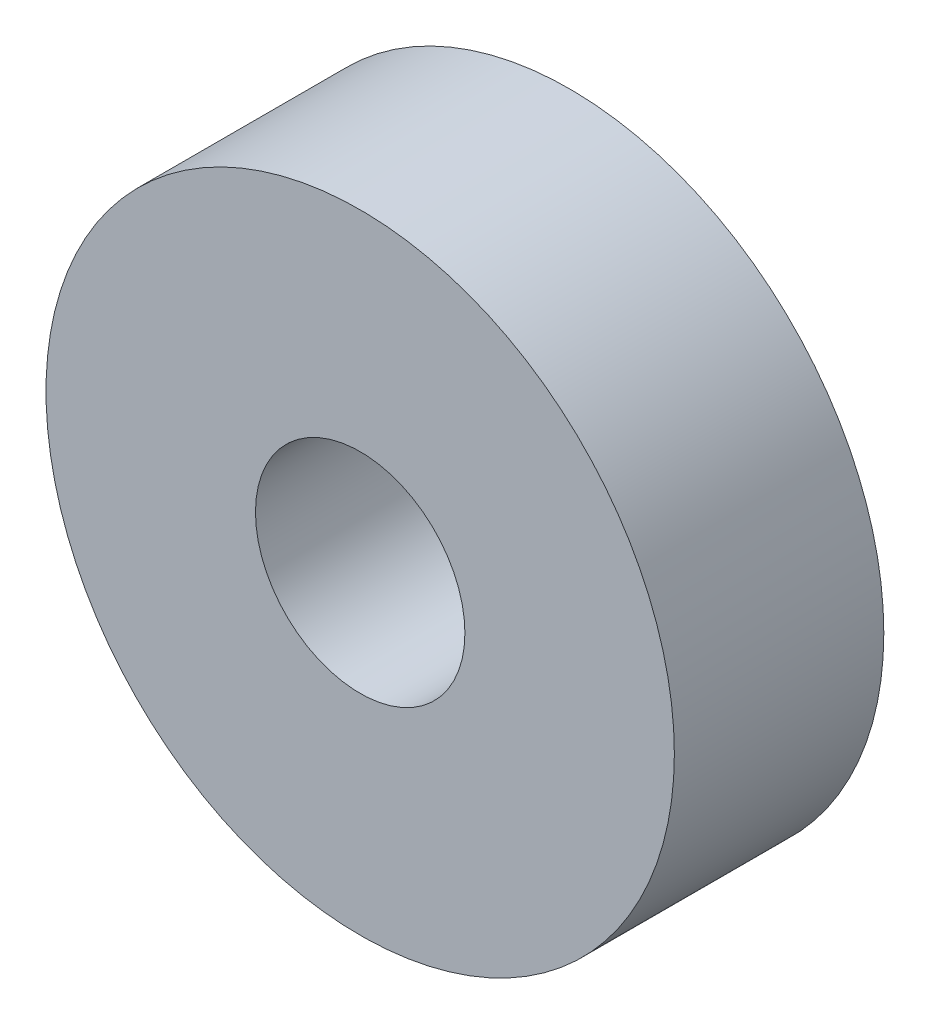
from build123d import *

# Parameters (mm, degrees)
SKETCH1_R           = 38.1
SKETCH1_R_2         = 12.7
BOSS_EXTRUDE1_DEPTH = 25.4


with BuildPart() as part:
    # Sketch1 → Boss-Extrude1 (new body)
    with BuildSketch(Plane.XY):
        Circle(SKETCH1_R)
        Circle(SKETCH1_R_2, mode=Mode.SUBTRACT)
    extrude(amount=BOSS_EXTRUDE1_DEPTH)


solid = part.part
